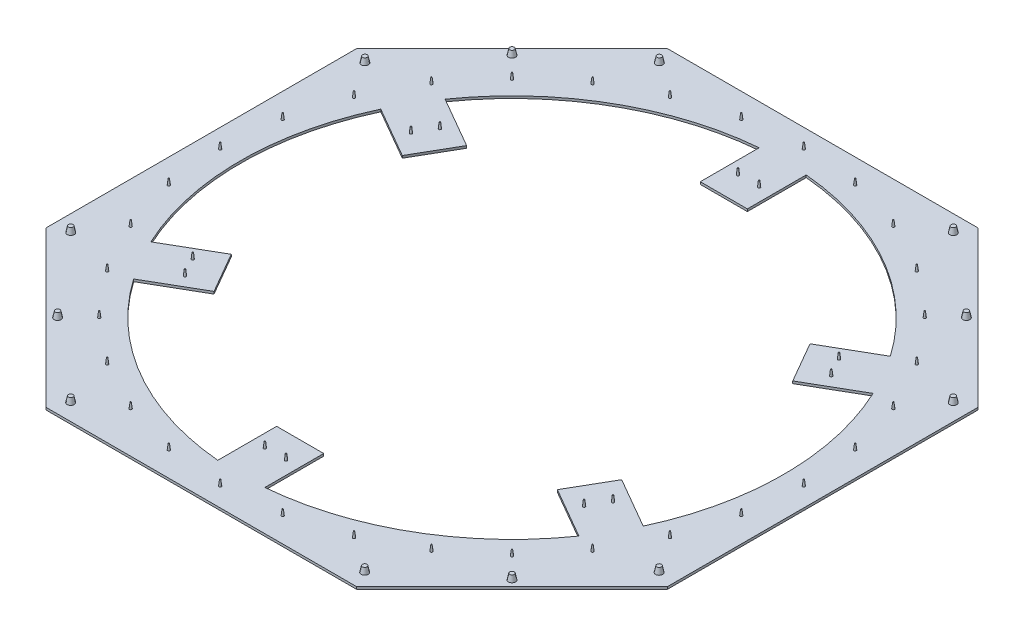
from build123d import *

# Parameters (mm, degrees)
BASEPLATE_PROFILE_DEPTH               = 2
SKETCH2_R                             = 1
M3_PINS_DEPTH                         = 5
M3_PINS_TAPER                         = 7
CIRPATTERN1_COUNT                     = 32
SKETCH4_R                             = 1
PILLAR_PINS_DEPTH                     = 5
PILLAR_PINS_DRAFT                     = 6
PILLAR_PINS_PROFILE_2_DEPTH           = 5
PILLAR_PINS_PROFILE_2_DRAFT           = 6
CIRPATTERN2_COPY_1_SKETCH_R           = 1
CIRPATTERN2_COPY_1_DEPTH              = 5
CIRPATTERN2_COPY_1_DRAFT              = 6
CIRPATTERN2_COPY_2_SKETCH_R           = 1
CIRPATTERN2_COPY_2_DEPTH              = 5
CIRPATTERN2_COPY_2_DRAFT              = 6
CIRPATTERN2_COPY_3_SKETCH_R           = 1
CIRPATTERN2_COPY_3_DEPTH              = 5
CIRPATTERN2_COPY_3_DRAFT              = 6
CIRPATTERN2_COPY_4_SKETCH_R           = 1
CIRPATTERN2_COPY_4_DEPTH              = 5
CIRPATTERN2_COPY_4_DRAFT              = 6
CIRPATTERN2_COPY_5_SKETCH_R           = 1
CIRPATTERN2_COPY_5_DEPTH              = 5
CIRPATTERN2_COPY_5_DRAFT              = 6
CIRPATTERN2_COPY_6_SKETCH_R           = 1
CIRPATTERN2_COPY_6_DEPTH              = 5
CIRPATTERN2_COPY_6_DRAFT              = 6
CIRPATTERN2_COPY_7_SKETCH_R           = 1
CIRPATTERN2_COPY_7_DEPTH              = 5
CIRPATTERN2_COPY_7_DRAFT              = 6
CIRPATTERN2_COPY_8_SKETCH_R           = 1
CIRPATTERN2_COPY_8_DEPTH              = 5
CIRPATTERN2_COPY_8_DRAFT              = 6
CIRPATTERN2_COPY_9_SKETCH_R           = 1
CIRPATTERN2_COPY_9_DEPTH              = 5
CIRPATTERN2_COPY_9_DRAFT              = 6
CIRPATTERN2_COPY_10_SKETCH_R          = 1
CIRPATTERN2_COPY_10_DEPTH             = 5
CIRPATTERN2_COPY_10_DRAFT             = 6
CIRPATTERN2_COPY_11_SKETCH_R          = 1
CIRPATTERN2_COPY_11_DEPTH             = 5
CIRPATTERN2_COPY_11_DRAFT             = 6
CIRPATTERN2_COPY_12_SKETCH_R          = 1
CIRPATTERN2_COPY_12_DEPTH             = 5
CIRPATTERN2_COPY_12_DRAFT             = 6
CIRPATTERN2_COPY_13_SKETCH_R          = 1
CIRPATTERN2_COPY_13_DEPTH             = 5
CIRPATTERN2_COPY_13_DRAFT             = 6
CIRPATTERN2_COPY_14_SKETCH_R          = 1
CIRPATTERN2_COPY_14_DEPTH             = 5
CIRPATTERN2_COPY_14_DRAFT             = 6
CIRPATTERN2_COPY_15_SKETCH_R          = 1
CIRPATTERN2_COPY_15_DEPTH             = 5
CIRPATTERN2_COPY_15_DRAFT             = 6
SKETCH5_R                             = 3
M8_HOLE_1_DEPTH                       = 5
M8_HOLE_1_TAPER                       = 12
M8_1_PATTERN_COUNT                    = 4
SKETCH6_R                             = 3
EXTRUDE_M8_2_DEPTH                    = 5
EXTRUDE_M8_2_TAPER                    = 12
M8_2_PATTERN_COUNT                    = 4
PATTERN_CIRCULAR_M8_3_COUNT           = 2
PATTERN_CIRCULAR_M8_3_ANGLE           = 36.9
PATTERN_CIRCULAR_M8_3_COPY_1_SKETCH_R = 3
PATTERN_CIRCULAR_M8_3_COPY_1_DEPTH    = 5
PATTERN_CIRCULAR_M8_3_COPY_1_TAPER    = 12
PATTERN_CIRCULAR_M8_3_COPY_2_SKETCH_R = 3
PATTERN_CIRCULAR_M8_3_COPY_2_DEPTH    = 5
PATTERN_CIRCULAR_M8_3_COPY_2_TAPER    = 12
PATTERN_CIRCULAR_M8_3_COPY_3_SKETCH_R = 3
PATTERN_CIRCULAR_M8_3_COPY_3_DEPTH    = 5
PATTERN_CIRCULAR_M8_3_COPY_3_TAPER    = 12
CUT_CENTER_DEPTH                      = 374.385859402
CIRPATTERN7_COUNT                     = 6


with BuildPart() as part:
    # Sketch1 → baseplate profile (new body)
    with BuildSketch(Plane(origin=(0, 0, 0), x_dir=(1, 0, 0), z_dir=(0, 1, 0))):
        Polygon((264, 0), (264, 131.98), (131.979594929, 264), (0, 264), (-131.98, 264), (-264, 131.979594929), (-264, 0), (-264, -131.98), (-131.979594929, -264), (0, -264), (131.98, -264), (264, -131.979594929), align=None)
    extrude(amount=-BASEPLATE_PROFILE_DEPTH)

    # Sketch2 → M3 pins (add)
    with BuildSketch(Plane(origin=(0, 0, 0), x_dir=(1, 0, 0), z_dir=(0, 1, 0))):
        with Locations((0, 248)):
            Circle(SKETCH2_R)
    m3_pins = extrude(amount=M3_PINS_DEPTH, taper=M3_PINS_TAPER)

    # CirPattern1: M3 pins ×32 about axis
    cirpattern1_axis = Axis((0, 0, 0), (0, 1, 0))
    for i in range(1, CIRPATTERN1_COUNT):
        add(m3_pins.rotate(cirpattern1_axis, i * 360 / CIRPATTERN1_COUNT))


with BuildPart() as pillar_pins_tool:
    # Sketch4 → pillar pins (with draft: the straight prism first)
    with BuildSketch(Plane(origin=(0, 0, 0), x_dir=(1, 0, 0), z_dir=(0, 1, 0))):
        with Locations((9, 201)):
            Circle(SKETCH4_R)
    extrude(amount=PILLAR_PINS_DEPTH)
    # pillar pins: the draft: its side faces are tilted about the plane it starts from
    pillar_pins_sides = [pillar_pins_tool.faces().sort_by_distance(p)[0] for p in [
        (8, 2.5, -201),
    ]]
    draft(pillar_pins_sides, Plane(origin=(0, 0, 0), x_dir=(1, 0, 0), z_dir=(0, 1, 0)), PILLAR_PINS_DRAFT)


with BuildPart() as part_1:
    add(part.part)

    # pillar pins: add pillar_pins_tool
    add(pillar_pins_tool.part)


with BuildPart() as pillar_pins_profile_2_tool:
    # Sketch4 → pillar pins profile 2 (with draft: the straight prism first)
    with BuildSketch(Plane(origin=(0, 0, 0), x_dir=(1, 0, 0), z_dir=(0, 1, 0))):
        with Locations((-9, 201)):
            Circle(SKETCH4_R)
    extrude(amount=PILLAR_PINS_PROFILE_2_DEPTH)
    # pillar pins profile 2: the draft: its side faces are tilted about the plane it starts from
    pillar_pins_profile_2_sides = [pillar_pins_profile_2_tool.faces().sort_by_distance(p)[0] for p in [
        (-10, 2.5, -201),
    ]]
    draft(pillar_pins_profile_2_sides, Plane(origin=(0, 0, 0), x_dir=(1, 0, 0), z_dir=(0, 1, 0)), PILLAR_PINS_PROFILE_2_DRAFT)


with BuildPart() as part_2:
    add(part_1.part)

    # pillar pins profile 2: add pillar_pins_profile_2_tool
    add(pillar_pins_profile_2_tool.part)


with BuildPart() as cirpattern2_copy_1_tool:
    # CirPattern2 copy 1 sketch → CirPattern2 copy 1 (with draft: the straight prism first)
    with BuildSketch(Plane(origin=(0, 0, 0), x_dir=(0.5000000000000001, 0, -0.8660254037844386), z_dir=(0, 1, 0))):
        with Locations((9, 201)):
            Circle(CIRPATTERN2_COPY_1_SKETCH_R)
    extrude(amount=CIRPATTERN2_COPY_1_DEPTH)
    # CirPattern2 copy 1: the draft: its side faces are tilted about the plane it starts from
    cirpattern2_copy_1_sides = [cirpattern2_copy_1_tool.faces().sort_by_distance(p)[0] for p in [
        (-170.071106161, 2.5, -107.42820323),
    ]]
    draft(cirpattern2_copy_1_sides, Plane(origin=(0, 0, 0), x_dir=(0.5000000000000001, 0, -0.8660254037844386), z_dir=(0, 1, 0)), CIRPATTERN2_COPY_1_DRAFT)


with BuildPart() as part_3:
    add(part_2.part)

    # CirPattern2 copy 1: add cirpattern2_copy_1_tool
    add(cirpattern2_copy_1_tool.part)


with BuildPart() as cirpattern2_copy_2_tool:
    # CirPattern2 copy 2 sketch → CirPattern2 copy 2 (with draft: the straight prism first)
    with BuildSketch(Plane(origin=(0, 0, 0), x_dir=(-0.4999999999999998, 0, -0.8660254037844387), z_dir=(0, 1, 0))):
        with Locations((9, 201)):
            Circle(CIRPATTERN2_COPY_2_SKETCH_R)
    extrude(amount=CIRPATTERN2_COPY_2_DEPTH)
    # CirPattern2 copy 2: the draft: its side faces are tilted about the plane it starts from
    cirpattern2_copy_2_sides = [cirpattern2_copy_2_tool.faces().sort_by_distance(p)[0] for p in [
        (-178.071106161, 2.5, 93.57179677),
    ]]
    draft(cirpattern2_copy_2_sides, Plane(origin=(0, 0, 0), x_dir=(-0.4999999999999998, 0, -0.8660254037844387), z_dir=(0, 1, 0)), CIRPATTERN2_COPY_2_DRAFT)


with BuildPart() as part_4:
    add(part_3.part)

    # CirPattern2 copy 2: add cirpattern2_copy_2_tool
    add(cirpattern2_copy_2_tool.part)


with BuildPart() as cirpattern2_copy_3_tool:
    # CirPattern2 copy 3 sketch → CirPattern2 copy 3 (with draft: the straight prism first)
    with BuildSketch(Plane(origin=(0, 0, 0), x_dir=(-1, 0, 0), z_dir=(0, 1, 0))):
        with Locations((9, 201)):
            Circle(CIRPATTERN2_COPY_3_SKETCH_R)
    extrude(amount=CIRPATTERN2_COPY_3_DEPTH)
    # CirPattern2 copy 3: the draft: its side faces are tilted about the plane it starts from
    cirpattern2_copy_3_sides = [cirpattern2_copy_3_tool.faces().sort_by_distance(p)[0] for p in [
        (-8, 2.5, 201),
    ]]
    draft(cirpattern2_copy_3_sides, Plane(origin=(0, 0, 0), x_dir=(-1, 0, 0), z_dir=(0, 1, 0)), CIRPATTERN2_COPY_3_DRAFT)


with BuildPart() as part_5:
    add(part_4.part)

    # CirPattern2 copy 3: add cirpattern2_copy_3_tool
    add(cirpattern2_copy_3_tool.part)


with BuildPart() as cirpattern2_copy_4_tool:
    # CirPattern2 copy 4 sketch → CirPattern2 copy 4 (with draft: the straight prism first)
    with BuildSketch(Plane(origin=(0, 0, 0), x_dir=(-0.5000000000000004, 0, 0.8660254037844384), z_dir=(0, 1, 0))):
        with Locations((9, 201)):
            Circle(CIRPATTERN2_COPY_4_SKETCH_R)
    extrude(amount=CIRPATTERN2_COPY_4_DEPTH)
    # CirPattern2 copy 4: the draft: its side faces are tilted about the plane it starts from
    cirpattern2_copy_4_sides = [cirpattern2_copy_4_tool.faces().sort_by_distance(p)[0] for p in [
        (170.071106161, 2.5, 107.42820323),
    ]]
    draft(cirpattern2_copy_4_sides, Plane(origin=(0, 0, 0), x_dir=(-0.5000000000000004, 0, 0.8660254037844384), z_dir=(0, 1, 0)), CIRPATTERN2_COPY_4_DRAFT)


with BuildPart() as part_6:
    add(part_5.part)

    # CirPattern2 copy 4: add cirpattern2_copy_4_tool
    add(cirpattern2_copy_4_tool.part)


with BuildPart() as cirpattern2_copy_5_tool:
    # CirPattern2 copy 5 sketch → CirPattern2 copy 5 (with draft: the straight prism first)
    with BuildSketch(Plane(origin=(0, 0, 0), x_dir=(0.5000000000000001, 0, 0.8660254037844386), z_dir=(0, 1, 0))):
        with Locations((9, 201)):
            Circle(CIRPATTERN2_COPY_5_SKETCH_R)
    extrude(amount=CIRPATTERN2_COPY_5_DEPTH)
    # CirPattern2 copy 5: the draft: its side faces are tilted about the plane it starts from
    cirpattern2_copy_5_sides = [cirpattern2_copy_5_tool.faces().sort_by_distance(p)[0] for p in [
        (178.071106161, 2.5, -93.57179677),
    ]]
    draft(cirpattern2_copy_5_sides, Plane(origin=(0, 0, 0), x_dir=(0.5000000000000001, 0, 0.8660254037844386), z_dir=(0, 1, 0)), CIRPATTERN2_COPY_5_DRAFT)


with BuildPart() as part_7:
    add(part_6.part)

    # CirPattern2 copy 5: add cirpattern2_copy_5_tool
    add(cirpattern2_copy_5_tool.part)


with BuildPart() as cirpattern2_copy_6_tool:
    # CirPattern2 copy 6 sketch → CirPattern2 copy 6 (with draft: the straight prism first)
    with BuildSketch(Plane(origin=(0, 0, 0), x_dir=(0.5000000000000001, 0, -0.8660254037844386), z_dir=(0, 1, 0))):
        with Locations((-9, 201)):
            Circle(CIRPATTERN2_COPY_6_SKETCH_R)
    extrude(amount=CIRPATTERN2_COPY_6_DEPTH)
    # CirPattern2 copy 6: the draft: its side faces are tilted about the plane it starts from
    cirpattern2_copy_6_sides = [cirpattern2_copy_6_tool.faces().sort_by_distance(p)[0] for p in [
        (-179.071106161, 2.5, -91.839745962),
    ]]
    draft(cirpattern2_copy_6_sides, Plane(origin=(0, 0, 0), x_dir=(0.5000000000000001, 0, -0.8660254037844386), z_dir=(0, 1, 0)), CIRPATTERN2_COPY_6_DRAFT)


with BuildPart() as part_8:
    add(part_7.part)

    # CirPattern2 copy 6: add cirpattern2_copy_6_tool
    add(cirpattern2_copy_6_tool.part)


with BuildPart() as cirpattern2_copy_7_tool:
    # CirPattern2 copy 7 sketch → CirPattern2 copy 7 (with draft: the straight prism first)
    with BuildSketch(Plane(origin=(0, 0, 0), x_dir=(-0.4999999999999998, 0, -0.8660254037844387), z_dir=(0, 1, 0))):
        with Locations((-9, 201)):
            Circle(CIRPATTERN2_COPY_7_SKETCH_R)
    extrude(amount=CIRPATTERN2_COPY_7_DEPTH)
    # CirPattern2 copy 7: the draft: its side faces are tilted about the plane it starts from
    cirpattern2_copy_7_sides = [cirpattern2_copy_7_tool.faces().sort_by_distance(p)[0] for p in [
        (-169.071106161, 2.5, 109.160254038),
    ]]
    draft(cirpattern2_copy_7_sides, Plane(origin=(0, 0, 0), x_dir=(-0.4999999999999998, 0, -0.8660254037844387), z_dir=(0, 1, 0)), CIRPATTERN2_COPY_7_DRAFT)


with BuildPart() as part_9:
    add(part_8.part)

    # CirPattern2 copy 7: add cirpattern2_copy_7_tool
    add(cirpattern2_copy_7_tool.part)


with BuildPart() as cirpattern2_copy_8_tool:
    # CirPattern2 copy 8 sketch → CirPattern2 copy 8 (with draft: the straight prism first)
    with BuildSketch(Plane(origin=(0, 0, 0), x_dir=(-1, 0, 0), z_dir=(0, 1, 0))):
        with Locations((-9, 201)):
            Circle(CIRPATTERN2_COPY_8_SKETCH_R)
    extrude(amount=CIRPATTERN2_COPY_8_DEPTH)
    # CirPattern2 copy 8: the draft: its side faces are tilted about the plane it starts from
    cirpattern2_copy_8_sides = [cirpattern2_copy_8_tool.faces().sort_by_distance(p)[0] for p in [
        (10, 2.5, 201),
    ]]
    draft(cirpattern2_copy_8_sides, Plane(origin=(0, 0, 0), x_dir=(-1, 0, 0), z_dir=(0, 1, 0)), CIRPATTERN2_COPY_8_DRAFT)


with BuildPart() as part_10:
    add(part_9.part)

    # CirPattern2 copy 8: add cirpattern2_copy_8_tool
    add(cirpattern2_copy_8_tool.part)


with BuildPart() as cirpattern2_copy_9_tool:
    # CirPattern2 copy 9 sketch → CirPattern2 copy 9 (with draft: the straight prism first)
    with BuildSketch(Plane(origin=(0, 0, 0), x_dir=(-0.5000000000000004, 0, 0.8660254037844384), z_dir=(0, 1, 0))):
        with Locations((-9, 201)):
            Circle(CIRPATTERN2_COPY_9_SKETCH_R)
    extrude(amount=CIRPATTERN2_COPY_9_DEPTH)
    # CirPattern2 copy 9: the draft: its side faces are tilted about the plane it starts from
    cirpattern2_copy_9_sides = [cirpattern2_copy_9_tool.faces().sort_by_distance(p)[0] for p in [
        (179.071106161, 2.5, 91.839745962),
    ]]
    draft(cirpattern2_copy_9_sides, Plane(origin=(0, 0, 0), x_dir=(-0.5000000000000004, 0, 0.8660254037844384), z_dir=(0, 1, 0)), CIRPATTERN2_COPY_9_DRAFT)


with BuildPart() as part_11:
    add(part_10.part)

    # CirPattern2 copy 9: add cirpattern2_copy_9_tool
    add(cirpattern2_copy_9_tool.part)


with BuildPart() as cirpattern2_copy_10_tool:
    # CirPattern2 copy 10 sketch → CirPattern2 copy 10 (with draft: the straight prism first)
    with BuildSketch(Plane(origin=(0, 0, 0), x_dir=(0.5000000000000001, 0, 0.8660254037844386), z_dir=(0, 1, 0))):
        with Locations((-9, 201)):
            Circle(CIRPATTERN2_COPY_10_SKETCH_R)
    extrude(amount=CIRPATTERN2_COPY_10_DEPTH)
    # CirPattern2 copy 10: the draft: its side faces are tilted about the plane it starts from
    cirpattern2_copy_10_sides = [cirpattern2_copy_10_tool.faces().sort_by_distance(p)[0] for p in [
        (169.071106161, 2.5, -109.160254038),
    ]]
    draft(cirpattern2_copy_10_sides, Plane(origin=(0, 0, 0), x_dir=(0.5000000000000001, 0, 0.8660254037844386), z_dir=(0, 1, 0)), CIRPATTERN2_COPY_10_DRAFT)


with BuildPart() as part_12:
    add(part_11.part)

    # CirPattern2 copy 10: add cirpattern2_copy_10_tool
    add(cirpattern2_copy_10_tool.part)


with BuildPart() as cirpattern2_copy_11_tool:
    # CirPattern2 copy 11 sketch → CirPattern2 copy 11 (with draft: the straight prism first)
    with BuildSketch(Plane(origin=(0, 0, 0), x_dir=(0.5000000000000001, 0, -0.8660254037844386), z_dir=(0, 1, 0))):
        with Locations((-9, 201)):
            Circle(CIRPATTERN2_COPY_11_SKETCH_R)
    extrude(amount=CIRPATTERN2_COPY_11_DEPTH)
    # CirPattern2 copy 11: the draft: its side faces are tilted about the plane it starts from
    cirpattern2_copy_11_sides = [cirpattern2_copy_11_tool.faces().sort_by_distance(p)[0] for p in [
        (-179.071106161, 2.5, -91.839745962),
    ]]
    draft(cirpattern2_copy_11_sides, Plane(origin=(0, 0, 0), x_dir=(0.5000000000000001, 0, -0.8660254037844386), z_dir=(0, 1, 0)), CIRPATTERN2_COPY_11_DRAFT)


with BuildPart() as part_13:
    add(part_12.part)

    # CirPattern2 copy 11: add cirpattern2_copy_11_tool
    add(cirpattern2_copy_11_tool.part)


with BuildPart() as cirpattern2_copy_12_tool:
    # CirPattern2 copy 12 sketch → CirPattern2 copy 12 (with draft: the straight prism first)
    with BuildSketch(Plane(origin=(0, 0, 0), x_dir=(-0.4999999999999998, 0, -0.8660254037844387), z_dir=(0, 1, 0))):
        with Locations((-9, 201)):
            Circle(CIRPATTERN2_COPY_12_SKETCH_R)
    extrude(amount=CIRPATTERN2_COPY_12_DEPTH)
    # CirPattern2 copy 12: the draft: its side faces are tilted about the plane it starts from
    cirpattern2_copy_12_sides = [cirpattern2_copy_12_tool.faces().sort_by_distance(p)[0] for p in [
        (-169.071106161, 2.5, 109.160254038),
    ]]
    draft(cirpattern2_copy_12_sides, Plane(origin=(0, 0, 0), x_dir=(-0.4999999999999998, 0, -0.8660254037844387), z_dir=(0, 1, 0)), CIRPATTERN2_COPY_12_DRAFT)


with BuildPart() as part_14:
    add(part_13.part)

    # CirPattern2 copy 12: add cirpattern2_copy_12_tool
    add(cirpattern2_copy_12_tool.part)


with BuildPart() as cirpattern2_copy_13_tool:
    # CirPattern2 copy 13 sketch → CirPattern2 copy 13 (with draft: the straight prism first)
    with BuildSketch(Plane(origin=(0, 0, 0), x_dir=(-1, 0, 0), z_dir=(0, 1, 0))):
        with Locations((-9, 201)):
            Circle(CIRPATTERN2_COPY_13_SKETCH_R)
    extrude(amount=CIRPATTERN2_COPY_13_DEPTH)
    # CirPattern2 copy 13: the draft: its side faces are tilted about the plane it starts from
    cirpattern2_copy_13_sides = [cirpattern2_copy_13_tool.faces().sort_by_distance(p)[0] for p in [
        (10, 2.5, 201),
    ]]
    draft(cirpattern2_copy_13_sides, Plane(origin=(0, 0, 0), x_dir=(-1, 0, 0), z_dir=(0, 1, 0)), CIRPATTERN2_COPY_13_DRAFT)


with BuildPart() as part_15:
    add(part_14.part)

    # CirPattern2 copy 13: add cirpattern2_copy_13_tool
    add(cirpattern2_copy_13_tool.part)


with BuildPart() as cirpattern2_copy_14_tool:
    # CirPattern2 copy 14 sketch → CirPattern2 copy 14 (with draft: the straight prism first)
    with BuildSketch(Plane(origin=(0, 0, 0), x_dir=(-0.5000000000000004, 0, 0.8660254037844384), z_dir=(0, 1, 0))):
        with Locations((-9, 201)):
            Circle(CIRPATTERN2_COPY_14_SKETCH_R)
    extrude(amount=CIRPATTERN2_COPY_14_DEPTH)
    # CirPattern2 copy 14: the draft: its side faces are tilted about the plane it starts from
    cirpattern2_copy_14_sides = [cirpattern2_copy_14_tool.faces().sort_by_distance(p)[0] for p in [
        (179.071106161, 2.5, 91.839745962),
    ]]
    draft(cirpattern2_copy_14_sides, Plane(origin=(0, 0, 0), x_dir=(-0.5000000000000004, 0, 0.8660254037844384), z_dir=(0, 1, 0)), CIRPATTERN2_COPY_14_DRAFT)


with BuildPart() as part_16:
    add(part_15.part)

    # CirPattern2 copy 14: add cirpattern2_copy_14_tool
    add(cirpattern2_copy_14_tool.part)


with BuildPart() as cirpattern2_copy_15_tool:
    # CirPattern2 copy 15 sketch → CirPattern2 copy 15 (with draft: the straight prism first)
    with BuildSketch(Plane(origin=(0, 0, 0), x_dir=(0.5000000000000001, 0, 0.8660254037844386), z_dir=(0, 1, 0))):
        with Locations((-9, 201)):
            Circle(CIRPATTERN2_COPY_15_SKETCH_R)
    extrude(amount=CIRPATTERN2_COPY_15_DEPTH)
    # CirPattern2 copy 15: the draft: its side faces are tilted about the plane it starts from
    cirpattern2_copy_15_sides = [cirpattern2_copy_15_tool.faces().sort_by_distance(p)[0] for p in [
        (169.071106161, 2.5, -109.160254038),
    ]]
    draft(cirpattern2_copy_15_sides, Plane(origin=(0, 0, 0), x_dir=(0.5000000000000001, 0, 0.8660254037844386), z_dir=(0, 1, 0)), CIRPATTERN2_COPY_15_DRAFT)


with BuildPart() as part_17:
    add(part_16.part)

    # CirPattern2 copy 15: add cirpattern2_copy_15_tool
    add(cirpattern2_copy_15_tool.part)

    # Sketch5 → M8 hole -1 (add)
    with BuildSketch(Plane(origin=(0, 0, 0), x_dir=(1, 0, 0), z_dir=(0, 1, 0))):
        with Locations((-193.040151264, 193.040151264)):
            Circle(SKETCH5_R)
    m8_hole_1 = extrude(amount=M8_HOLE_1_DEPTH, taper=M8_HOLE_1_TAPER)

    # M8 -1 pattern: M8 hole -1 ×4 about axis
    m8_1_pattern_axis = Axis((0, 0, 0), (0, 1, 0))
    for i in range(1, M8_1_PATTERN_COUNT):
        add(m8_hole_1.rotate(m8_1_pattern_axis, i * 360 / M8_1_PATTERN_COUNT))

    # Sketch6 → Extrude M8 -2 (add)
    with BuildSketch(Plane(origin=(0, 0, 0), x_dir=(1, 0, 0), z_dir=(0, 1, 0))):
        with Locations((-125, -250)):
            Circle(SKETCH6_R)
    extrude_m8_2 = extrude(amount=EXTRUDE_M8_2_DEPTH, taper=EXTRUDE_M8_2_TAPER)

    # M8 -2 pattern: Extrude M8 -2 ×4 about axis
    m8_2_pattern_axis = Axis((0, 0, 0), (0, 1, 0))
    for i in range(1, M8_2_PATTERN_COUNT):
        add(extrude_m8_2.rotate(m8_2_pattern_axis, i * 360 / M8_2_PATTERN_COUNT))

    # Pattern Circular M8 -3: Extrude M8 -2 ×2 about axis
    pattern_circular_m8_3_axis = Axis((0, 0, 0), (0, -1, 0))
    for i in range(1, PATTERN_CIRCULAR_M8_3_COUNT):
        add(extrude_m8_2.rotate(pattern_circular_m8_3_axis, i * PATTERN_CIRCULAR_M8_3_ANGLE / (PATTERN_CIRCULAR_M8_3_COUNT - 1)))

    # Pattern Circular M8 -3 copy 1 sketch → Pattern Circular M8 -3 copy 1 (add)
    with BuildSketch(Plane(origin=(0, 0, 0), x_dir=(0.6004202253258852, 0, -0.7996846584870897), z_dir=(0, 1, 0))):
        with Locations((-125, -250)):
            Circle(PATTERN_CIRCULAR_M8_3_COPY_1_SKETCH_R)
    extrude(amount=PATTERN_CIRCULAR_M8_3_COPY_1_DEPTH, taper=PATTERN_CIRCULAR_M8_3_COPY_1_TAPER)

    # Pattern Circular M8 -3 copy 2 sketch → Pattern Circular M8 -3 copy 2 (add)
    with BuildSketch(Plane(origin=(0, 0, 0), x_dir=(-0.7996846584870896, 0, -0.6004202253258853), z_dir=(0, 1, 0))):
        with Locations((-125, -250)):
            Circle(PATTERN_CIRCULAR_M8_3_COPY_2_SKETCH_R)
    extrude(amount=PATTERN_CIRCULAR_M8_3_COPY_2_DEPTH, taper=PATTERN_CIRCULAR_M8_3_COPY_2_TAPER)

    # Pattern Circular M8 -3 copy 3 sketch → Pattern Circular M8 -3 copy 3 (add)
    with BuildSketch(Plane(origin=(0, 0, 0), x_dir=(-0.6004202253258853, 0, 0.7996846584870896), z_dir=(0, 1, 0))):
        with Locations((-125, -250)):
            Circle(PATTERN_CIRCULAR_M8_3_COPY_3_SKETCH_R)
    extrude(amount=PATTERN_CIRCULAR_M8_3_COPY_3_DEPTH, taper=PATTERN_CIRCULAR_M8_3_COPY_3_TAPER)

    # Sketch8 → cut center (cut, through all)
    with BuildSketch(Plane(origin=(0, 0, 0), x_dir=(1, 0, 0), z_dir=(0, 1, 0))):
        with BuildLine():
            Line((115.433963806, -199.937490231), (0, 0))
            Line((0, 0), (0, -180))
            Line((0, -180), (20, -180))
            Line((20, -180), (20, -230))
            ThreePointArc((20, -230), (69.365180469, -220.200980331), (115.433963806, -199.937490231))
        make_face()
        with BuildLine():
            Line((0, -180), (0, 0))
            Line((0, 0), (-115.433963806, -199.937490231))
            ThreePointArc((-115.433963806, -199.937490231), (-69.365180469, -220.200980331), (-20, -230))
            Line((-20, -230), (-20, -180))
            Line((-20, -180), (0, -180))
        make_face()
    cut_center = extrude(amount=-CUT_CENTER_DEPTH, mode=Mode.SUBTRACT)

    # CirPattern7: cut center ×6 about axis
    cirpattern7_axis = Axis((0, 0, 0), (0, 1, 0))
    for i in range(1, CIRPATTERN7_COUNT):
        add(cut_center.rotate(cirpattern7_axis, i * 360 / CIRPATTERN7_COUNT), mode=Mode.SUBTRACT)


solid = part_17.part
